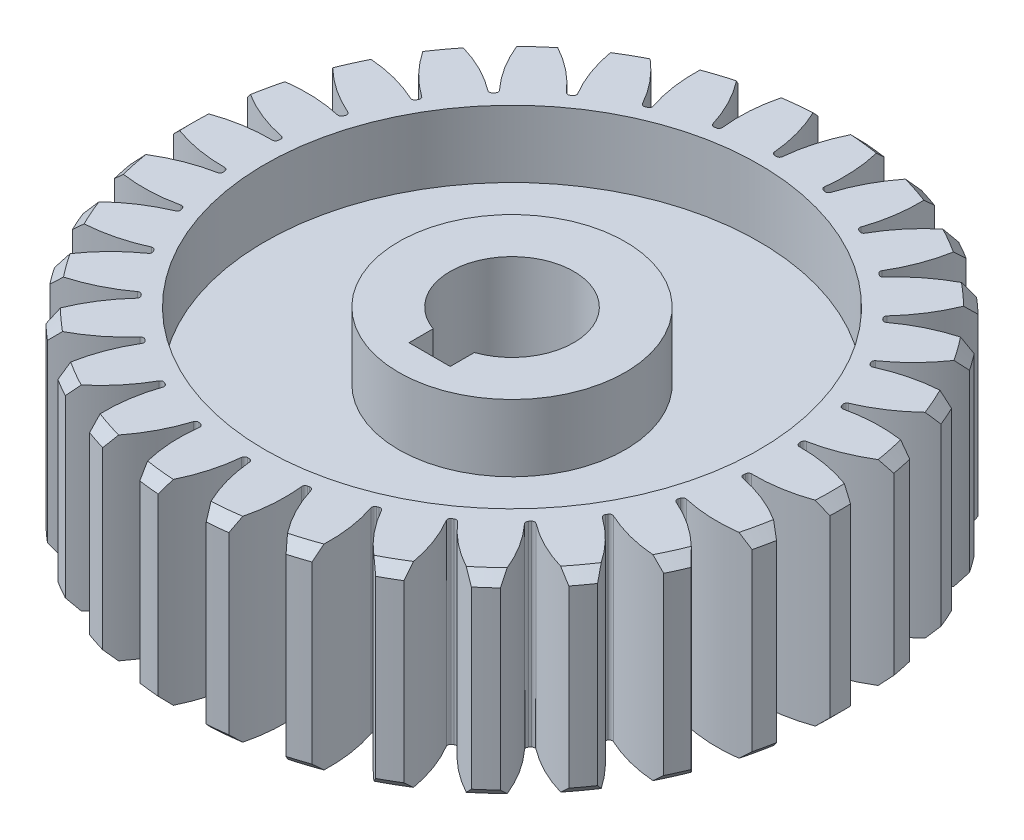
from build123d import *

# Parameters (mm, degrees)
SKETCH2_R                    = 11
BOSS_EXTRUDE1_DEPTH          = 9.5
SKETCH4_R                    = 24
BOSS_EXTRUDE2_DEPTH          = 3
SKETCH4_3_R                  = 25.5
SKETCH4_3_R_2                = 24
BOSS_EXTRUDE3_DEPTH          = 9.5
CUT_EXTRUDE2_DEPTH           = 38.292760692
CUT_EXTRUDE2_DEPTH_BACK      = 38.292760692
BOSS_EXTRUDE5_DEPTH          = 9.5
CHAMFER1_SIZE                = 1
CIRPATTERN2_COUNT            = 30
CHAMFER1_OF_CIRPATTERN2_SIZE = 1


with BuildPart() as part:
    # Sketch2 → Boss-Extrude1 (new, symmetric)
    with BuildSketch(Plane(origin=(0, 0, 0), x_dir=(-1, 0, 0), z_dir=(0, 1, 0))):
        Circle(SKETCH2_R)
        with BuildLine():
            Line((-2, 5.656854249), (-2, 8))
            Line((-2, 8), (2, 8))
            Line((2, 8), (2, 5.656854249))
            ThreePointArc((2, 5.656854249), (0, -6), (-2, 5.656854249))
        make_face(mode=Mode.SUBTRACT)
    extrude(amount=BOSS_EXTRUDE1_DEPTH, both=True)

    # Sketch4 → Boss-Extrude2 (add, symmetric)
    with BuildSketch(Plane(origin=(0, 0, 0), x_dir=(-1, 0, 0), z_dir=(0, 1, 0))):
        Circle(SKETCH4_R)
    extrude(amount=BOSS_EXTRUDE2_DEPTH, both=True)

    # Sketch4<3> → Boss-Extrude3 (add, symmetric)
    with BuildSketch(Plane(origin=(0, 0, 0), x_dir=(-1, 0, 0), z_dir=(0, 1, 0))):
        Circle(SKETCH4_3_R)
        Circle(SKETCH4_3_R_2, mode=Mode.SUBTRACT)
    extrude(amount=BOSS_EXTRUDE3_DEPTH, both=True)

    # Sketch2<4> → Cut-Extrude2 (cut, two sides: drawn at the far end of the back side and taken through both)
    with BuildSketch(Plane(origin=(0, 0, 0), x_dir=(-1, 0, 0), z_dir=(0, 1, 0)).offset(-CUT_EXTRUDE2_DEPTH_BACK)):
        with BuildLine():
            Line((-2, 5.656854249), (-2, 8))
            Line((-2, 8), (2, 8))
            Line((2, 8), (2, 5.656854249))
            ThreePointArc((2, 5.656854249), (0, -6), (-2, 5.656854249))
        make_face()
    extrude(amount=CUT_EXTRUDE2_DEPTH + CUT_EXTRUDE2_DEPTH_BACK, mode=Mode.SUBTRACT)

    # Sketch6 → Boss-Extrude5 (add, symmetric)
    with BuildSketch(Plane(origin=(0, 0, 0), x_dir=(-1, 0, 0), z_dir=(0, 1, 0))):
        with BuildLine():
            ThreePointArc((-4.222001059, 31.720257046), (-3.228680999, 31.836702389), (-2.23220716, 31.922049608))
            ThreePointArc((-2.23220716, 31.922049608), (-0.931383513, 28.952891728), (-0.298835752, 25.773595577))
            ThreePointArc((-0.298835752, 25.773595577), (-0.202581679, 25.578729434), (0, 25.5))
            ThreePointArc((0, 25.5), (-2.572855171, 25.369872216), (-5.119451523, 24.980816962))
            ThreePointArc((-5.119451523, 24.980816962), (-4.936800373, 25.098614322), (-4.881627918, 25.308837205))
            ThreePointArc((-4.881627918, 25.308837205), (-4.900243317, 28.550394569), (-4.222001059, 31.720257046))
        make_face()
    boss_extrude5 = extrude(amount=BOSS_EXTRUDE5_DEPTH, both=True)

    # Chamfer1
    chamfer1_edges = [part.edges().sort_by_distance(p)[0] for p in [
        (3.228680999, -9.5, 31.836702389),
        (3.228680999, 9.5, 31.836702389),
    ]]
    chamfer(chamfer1_edges, length=CHAMFER1_SIZE)

    # CirPattern2: Boss-Extrude5 ×30 about axis
    cirpattern2_axis = Axis((0, 9.5, 0), (0, 1, 0))
    for i in range(1, CIRPATTERN2_COUNT):
        add(boss_extrude5.rotate(cirpattern2_axis, i * 360 / CIRPATTERN2_COUNT))

    # Chamfer1 of CirPattern2
    chamfer1_of_cirpattern2_edges = [part.edges().sort_by_distance(p)[0] for p in [
        (9.777349196, -9.5, 30.469713531),
        (9.777349196, 9.5, 30.469713531),
        (15.898700317, -9.5, 27.771051983),
        (15.898700317, 9.5, 27.771051983),
        (21.325201943, -9.5, 23.858662202),
        (21.325201943, 9.5, 23.858662202),
        (25.819689915, -9.5, 18.903534397),
        (25.819689915, 9.5, 18.903534397),
        (29.185733541, -9.5, 13.122231429),
        (29.185733541, 9.5, 13.122231429),
        (31.276220563, -9.5, 6.76742398),
        (31.276220563, 9.5, 6.76742398),
        (31.999786665, -9.5, 0.11684763),
        (31.999786665, 9.5, 0.11684763),
        (31.324808539, -9.5, -6.538835523),
        (31.324808539, 9.5, -6.538835523),
        (29.280785966, -9.5, -12.908740186),
        (29.280785966, 9.5, -12.908740186),
        (25.957052542, -9.5, -18.71447096),
        (25.957052542, 9.5, -18.71447096),
        (21.498871366, -9.5, -23.702289552),
        (21.498871366, 9.5, -23.702289552),
        (16.101086348, -9.5, -27.654204353),
        (16.101086348, 9.5, -27.654204353),
        (9.999606596, -9.5, -30.397497725),
        (9.999606596, 9.5, -30.397497725),
        (3.461096051, -9.5, -31.812274583),
        (3.461096051, 9.5, -31.812274583),
        (-3.228680999, -9.5, -31.836702389),
        (-3.228680999, 9.5, -31.836702389),
        (-9.777349196, -9.5, -30.469713531),
        (-9.777349196, 9.5, -30.469713531),
        (-15.898700317, -9.5, -27.771051983),
        (-15.898700317, 9.5, -27.771051983),
        (-21.325201943, -9.5, -23.858662202),
        (-21.325201943, 9.5, -23.858662202),
        (-25.819689915, -9.5, -18.903534397),
        (-25.819689915, 9.5, -18.903534397),
        (-29.185733541, -9.5, -13.122231429),
        (-29.185733541, 9.5, -13.122231429),
        (-31.276220563, -9.5, -6.76742398),
        (-31.276220563, 9.5, -6.76742398),
        (-31.999786665, -9.5, -0.11684763),
        (-31.999786665, 9.5, -0.11684763),
        (-31.324808539, -9.5, 6.538835523),
        (-31.324808539, 9.5, 6.538835523),
        (-29.280785966, -9.5, 12.908740186),
        (-29.280785966, 9.5, 12.908740186),
        (-25.957052542, -9.5, 18.71447096),
        (-25.957052542, 9.5, 18.71447096),
        (-21.498871366, -9.5, 23.702289552),
        (-21.498871366, 9.5, 23.702289552),
        (-16.101086348, -9.5, 27.654204353),
        (-16.101086348, 9.5, 27.654204353),
        (-9.999606596, -9.5, 30.397497725),
        (-9.999606596, 9.5, 30.397497725),
        (-3.461096051, -9.5, 31.812274583),
        (-3.461096051, 9.5, 31.812274583),
    ]]
    chamfer(chamfer1_of_cirpattern2_edges, length=CHAMFER1_OF_CIRPATTERN2_SIZE)


solid = part.part
